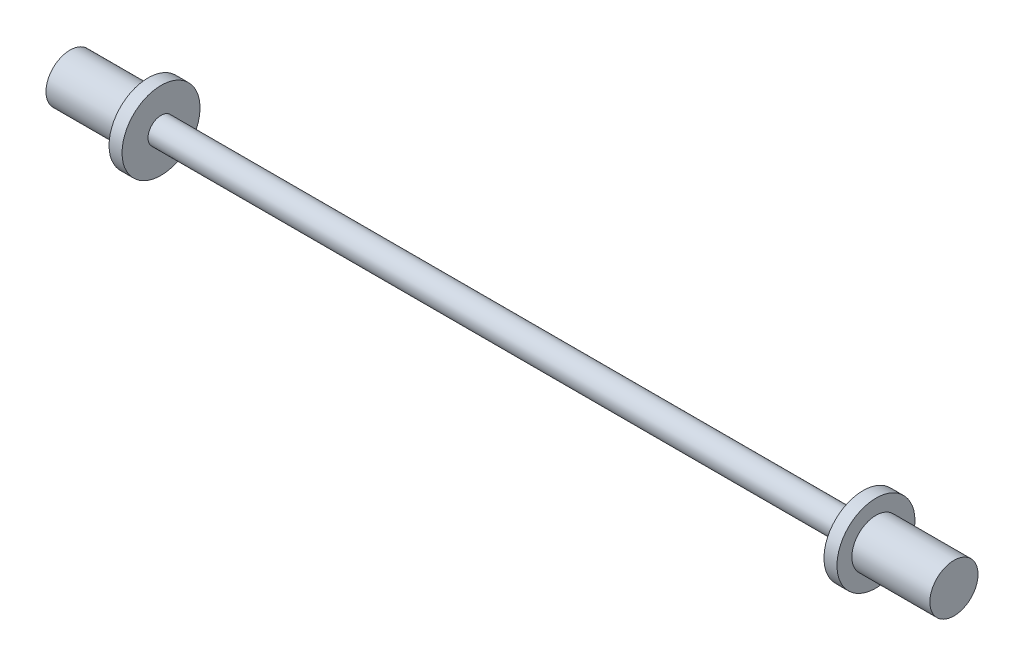
from build123d import *

# Parameters (mm, degrees)
BOSS_EXTRUDE1_DEPTH      = 171.45
BOSS_EXTRUDE1_DEPTH_BACK = 171.45
SKETCH2_R                = 6.35
SKETCH3_R                = 19.05
BOSS_EXTRUDE2_DEPTH      = 6.35
BOSS_EXTRUDE4_START      = 6.35
SKETCH7_R                = 19.05
BOSS_EXTRUDE4_DEPTH      = 6.35
SKETCH9_R                = 11.77
BOSS_EXTRUDE6_DEPTH      = 38.1
BOSS_EXTRUDE7_START      = 38.1
SKETCH10_R               = 11.77
BOSS_EXTRUDE7_DEPTH      = 38.1


with BuildPart() as part:
    # Sketch2 → Boss-Extrude1 (new, two sides: drawn at the far end of the back side and taken through both)
    with BuildSketch(Plane(origin=(0, 0, 0), x_dir=(0, 0, -1), z_dir=(1, 0, 0)).offset(-BOSS_EXTRUDE1_DEPTH_BACK)):
        Circle(SKETCH2_R)
    extrude(amount=BOSS_EXTRUDE1_DEPTH + BOSS_EXTRUDE1_DEPTH_BACK)

    # Sketch3 → Boss-Extrude2 (add)
    with BuildSketch(Plane(origin=(171.45, 0, 0), x_dir=(0, 0, -1), z_dir=(1, 0, 0))):
        Circle(SKETCH3_R)
    extrude(amount=BOSS_EXTRUDE2_DEPTH)

    # Sketch7 → Boss-Extrude4 (add)
    with BuildSketch(Plane.ZY.offset(171.45).offset(BOSS_EXTRUDE4_START)):
        Circle(SKETCH7_R)
    extrude(amount=-BOSS_EXTRUDE4_DEPTH)

    # Sketch9 → Boss-Extrude6 (add)
    with BuildSketch(Plane.ZY.offset(177.8)):
        Circle(SKETCH9_R)
    extrude(amount=BOSS_EXTRUDE6_DEPTH)

    # Sketch10 → Boss-Extrude7 (add)
    with BuildSketch(Plane(origin=(177.8, 0, 0), x_dir=(0, 0, -1), z_dir=(1, 0, 0)).offset(BOSS_EXTRUDE7_START)):
        Circle(SKETCH10_R)
    extrude(amount=-BOSS_EXTRUDE7_DEPTH)


solid = part.part
